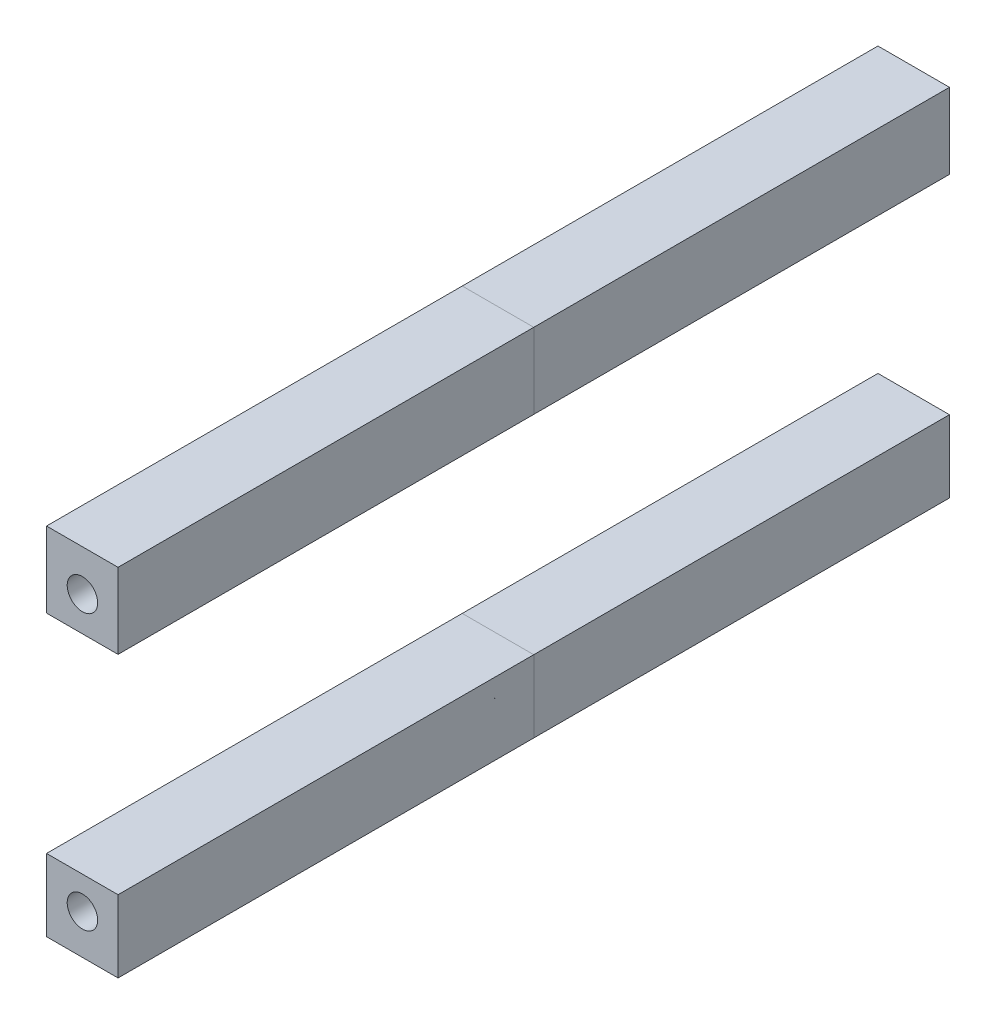
from build123d import *

# Parameters (mm, degrees)
SKETCH1_W                = 16
SKETCH1_H                = 57.332
SKETCH1_R                = 2.25
BOSS_EXTRUDE1_DEPTH      = 12.7
BOSS_EXTRUDE3_DEPTH      = 48.768
BOSS_EXTRUDE3_DEPTH_BACK = 12.7
SKETCH4_W                = 10.573315132
SKETCH4_H                = 11.154301746
SKETCH4_R                = 2.25
SKETCH4_H_2              = 10.666438104
SKETCH5_W                = 10.573315132
SKETCH5_H                = 10.666438104
CUT_EXTRUDE1_DEPTH       = 47.752


with BuildPart() as part:
    # Sketch1 → Boss-Extrude1 (new body)
    with BuildSketch(Plane.XY):
        with Locations((34.668274257, -42)):
            Rectangle(SKETCH1_W, SKETCH1_H)
        with Locations((34.668274257, -19.403489859)):
            Circle(SKETCH1_R, mode=Mode.SUBTRACT)
        with Locations((34.668274257, -60.043489859)):
            Circle(SKETCH1_R, mode=Mode.SUBTRACT)
    extrude(amount=-BOSS_EXTRUDE1_DEPTH)

    # Sketch4 → Boss-Extrude3 (add, two sides: drawn at the far end of the back side and taken through both)
    # profile 1 of 2: a face of its own
    with BuildSketch(Plane(origin=(0, 0, -12.7), x_dir=(-1, 0, 0), z_dir=(0, 0, -1)).offset(-BOSS_EXTRUDE3_DEPTH_BACK)):
        with Locations((-34.64798409, -18.911150873)):
            Rectangle(SKETCH4_W, SKETCH4_H)
        with Locations(Location((-34.668274257, -19.403489859, 0), (0, 0, 180))):
            Circle(SKETCH4_R, mode=Mode.SUBTRACT)
    # profile 2 of 2: a face of its own
    with BuildSketch(Plane(origin=(0, 0, -12.7), x_dir=(-1, 0, 0), z_dir=(0, 0, -1)).offset(-BOSS_EXTRUDE3_DEPTH_BACK)):
        with Locations((-34.64798409, -60.593056671)):
            Rectangle(SKETCH4_W, SKETCH4_H_2)
        with Locations(Location((-34.668274257, -60.043489859, 0), (0, 0, 180))):
            Circle(SKETCH4_R, mode=Mode.SUBTRACT)
    extrude(amount=BOSS_EXTRUDE3_DEPTH + BOSS_EXTRUDE3_DEPTH_BACK)

    # Sketch5 → Cut-Extrude1 (cut)
    with BuildSketch(Plane(origin=(0, 0, -12.7), x_dir=(-1, 0, 0), z_dir=(0, 0, -1))):
        Polygon((-39.934641656, -13.334), (-42.668274257, -13.334), (-42.668274257, -70.666), (-26.668274257, -70.666), (-26.668274257, -13.334), (-29.361326524, -13.334), (-29.361326524, -24.488301746), (-39.934641656, -24.488301746), align=None)
        with Locations((-34.64798409, -60.593056671)):
            Rectangle(SKETCH5_W, SKETCH5_H, mode=Mode.SUBTRACT)
    extrude(amount=-CUT_EXTRUDE1_DEPTH, mode=Mode.SUBTRACT)


with BuildPart() as cut_extrude1_piece_1:
    # of the separate pieces the step leaves, piece 1, a body of its own (cut_extrude1_pieces)
    add(part.part.solids().sort_by_distance((29.361326524, -13.334, 0))[0])


with BuildPart() as cut_extrude1_piece_2:
    # of the separate pieces the step leaves, piece 2, a body of its own (cut_extrude1_pieces)
    add(part.part.solids().sort_by_distance((29.361326524, -65.926275723, 0))[0])


with BuildPart() as body_3:
    # Mirror3: mirrored copy
    add(cut_extrude1_piece_2.part.mirror(Plane(origin=(0, 0, -61.468), x_dir=(1, 0, 0), z_dir=(0, 0, -1))))


with BuildPart() as body_4:
    # Mirror3 2: mirrored copy
    add(cut_extrude1_piece_1.part.mirror(Plane(origin=(0, 0, -61.468), x_dir=(1, 0, 0), z_dir=(0, 0, -1))))


solid = Compound([cut_extrude1_piece_1.part, cut_extrude1_piece_2.part, body_3.part, body_4.part])
